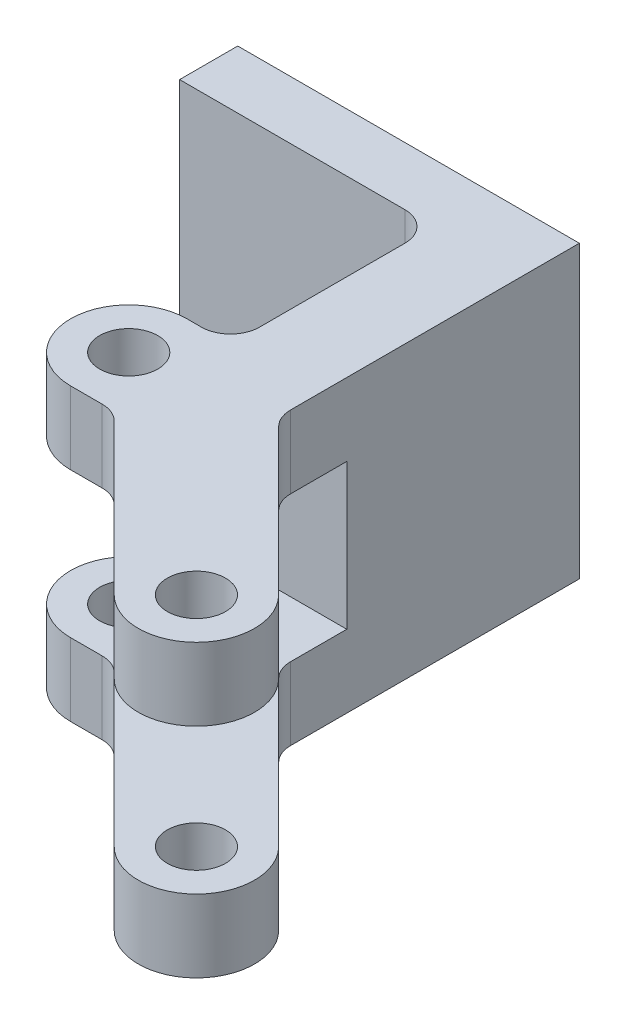
from build123d import *

# Parameters (mm, degrees)
BOSS_EXTRUDE1_DEPTH = 10
SKETCH3_R           = 2
BOSS_EXTRUDE2_DEPTH = 10
BOSS_EXTRUDE3_DEPTH = 20
SKETCH6_R           = 2
CUT_EXTRUDE2_DEPTH  = 20
SKETCH4_W           = 40
SKETCH4_H           = 10
CUT_EXTRUDE1_DEPTH  = 31.090136351
FILLET1_R           = 2


with BuildPart() as part:
    # Sketch1 → Boss-Extrude1 (new, symmetric)
    with BuildSketch(Plane(origin=(0, 0, 0), x_dir=(1, 0, 0), z_dir=(0, 1, 0))):
        Polygon((0, -4), (0, 18), (-17.5, 18), (-17.5, 22), (6, 22), (6, -4), align=None)
    extrude(amount=BOSS_EXTRUDE1_DEPTH, both=True)

    # Sketch3 → Boss-Extrude2 (add, symmetric)
    with BuildSketch(Plane(origin=(0, 0, 0), x_dir=(1, 0, 0), z_dir=(0, 1, 0))):
        with BuildLine():
            Line((-3, 4), (0, 4))
            Line((0, 4), (0, -4))
            Line((0, -4), (-3, -4))
            ThreePointArc((-3, -4), (-7, 0), (-3, 4))
        make_face()
        with Locations(Location((-3, 0, 0), (0, 0, 270))):
            Circle(SKETCH3_R, mode=Mode.SUBTRACT)
    extrude(amount=BOSS_EXTRUDE2_DEPTH, both=True)

    # Sketch5 → Boss-Extrude3 (add)
    with BuildSketch(Plane(origin=(0, 10, 0), x_dir=(1, 0, 0), z_dir=(0, 1, 0))):
        with BuildLine():
            Line((0, -4), (10.949747468, -14.949747468))
            ThreePointArc((10.949747468, -14.949747468), (16.606601718, -14.949747468), (16.606601718, -9.292893219))
            Line((16.606601718, -9.292893219), (6, 1.313708499))
            Line((6, 1.313708499), (0, -4))
        make_face()
    extrude(amount=-BOSS_EXTRUDE3_DEPTH)

    # Sketch6 → Cut-Extrude2 (cut)
    with BuildSketch(Plane(origin=(0, 10, 0), x_dir=(1, 0, 0), z_dir=(0, 1, 0))):
        with Locations(Location((13.778174593, -12.121320344, 0), (0, 0, 270))):
            Circle(SKETCH6_R)
    extrude(amount=-CUT_EXTRUDE2_DEPTH, mode=Mode.SUBTRACT)

    # Sketch4 → Cut-Extrude1 (cut, through all)
    with BuildSketch(Plane.XY.offset(-6)):
        with Locations((2.5, 0)):
            Rectangle(SKETCH4_W, SKETCH4_H)
    extrude(amount=CUT_EXTRUDE1_DEPTH, mode=Mode.SUBTRACT)

    # Fillet1
    fillet1_edges = [part.edges().sort_by_distance(p)[0] for p in [
        (6, 7.5, -1.313708499),
        (6, -7.5, -1.313708499),
        (0, -7.5, 4),
        (0, 7.5, 4),
        (0, 0, -18),
        (0, -7.5, -4),
        (0, 7.5, -4),
    ]]
    fillet(fillet1_edges, radius=FILLET1_R)


solid = part.part
